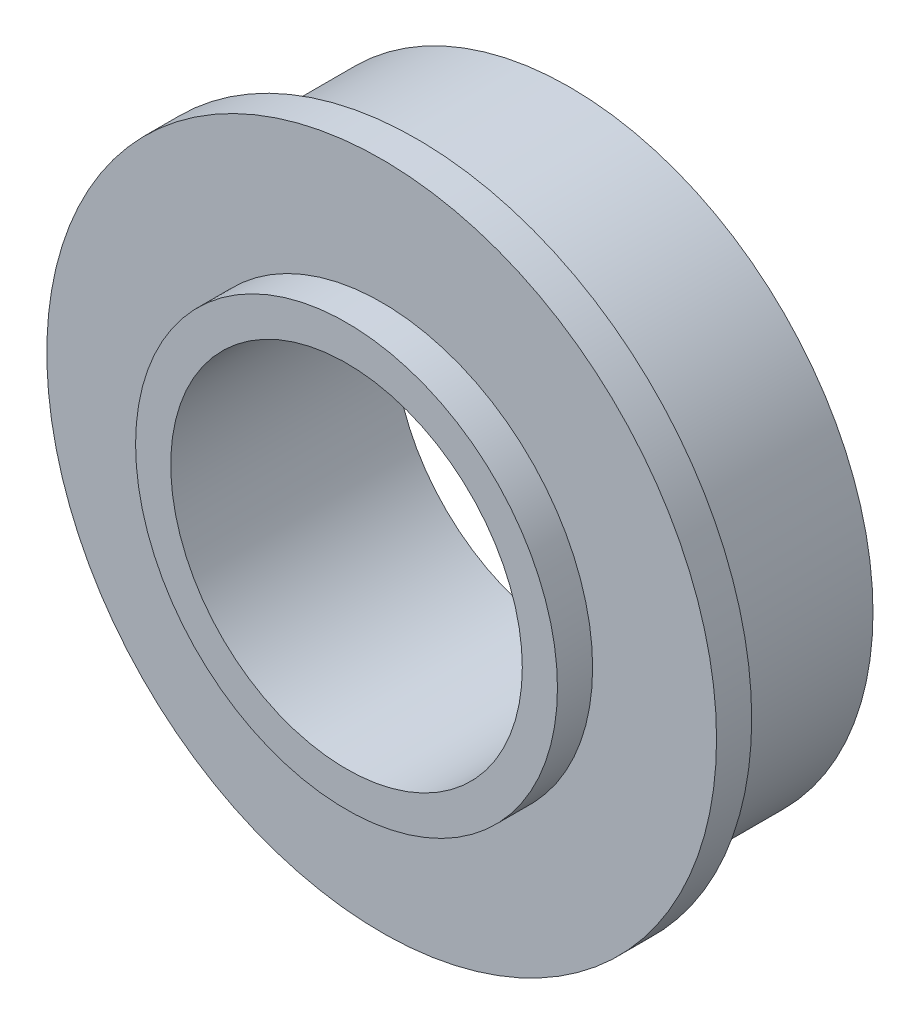
from build123d import *

# Parameters (mm, degrees)
SKETCH1_R           = 17.25
SKETCH1_R_2         = 10
BOSS_EXTRUDE1_DEPTH = 8.7
SKETCH2_R           = 19.05
SKETCH2_R_2         = 10
BOSS_EXTRUDE2_DEPTH = 2
SKETCH3_R           = 12
SKETCH3_R_2         = 10
BOSS_EXTRUDE3_DEPTH = 2


with BuildPart() as part:
    # Sketch1 → Boss-Extrude1 (new body)
    with BuildSketch(Plane.XY):
        Circle(SKETCH1_R)
        Circle(SKETCH1_R_2, mode=Mode.SUBTRACT)
    extrude(amount=BOSS_EXTRUDE1_DEPTH)

    # Sketch2 → Boss-Extrude2 (add)
    with BuildSketch(Plane.XY.offset(8.7)):
        Circle(SKETCH2_R)
        Circle(SKETCH2_R_2, mode=Mode.SUBTRACT)
    extrude(amount=BOSS_EXTRUDE2_DEPTH)

    # Sketch3 → Boss-Extrude3 (add)
    with BuildSketch(Plane.XY.offset(10.7)):
        Circle(SKETCH3_R)
        Circle(SKETCH3_R_2, mode=Mode.SUBTRACT)
    extrude(amount=BOSS_EXTRUDE3_DEPTH)


solid = part.part
